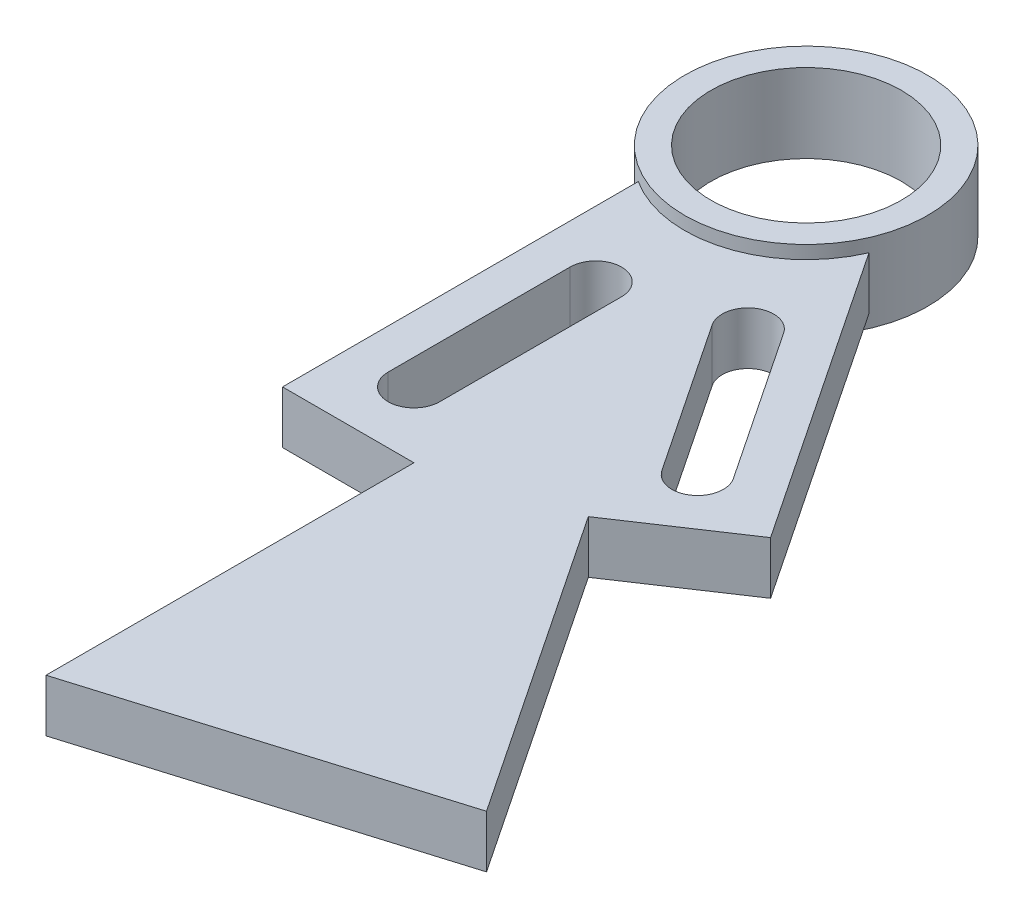
from build123d import *

# Parameters (mm, degrees)
SKETCH1_R             = 11.5062
BEARING_EXTRUDE_DEPTH = 4.7625
BOSS_EXTRUDE2_DEPTH   = 3.175


with BuildPart() as part:
    # Sketch1 → Bearing extrude (new, symmetric)
    with BuildSketch(Plane(origin=(0, 0, 0), x_dir=(1, 0, 0), z_dir=(0, 1, 0))):
        with BuildLine():
            ThreePointArc((14.6812, 0), (-7.035822924, 12.885450292), (-7.9375, -12.350454534))
            ThreePointArc((-7.9375, -12.350454534), (4.257656572, -14.050266686), (13.457937336, -5.866988674))
            ThreePointArc((13.457937336, -5.866988674), (14.372131071, -2.996578368), (14.6812, 0))
        make_face()
        Circle(SKETCH1_R, mode=Mode.SUBTRACT)
    extrude(amount=BEARING_EXTRUDE_DEPTH, both=True)

    # Sketch1<5> → Boss-Extrude2 (add, symmetric)
    with BuildSketch(Plane(origin=(0, 0, 0), x_dir=(1, 0, 0), z_dir=(0, 1, 0))):
        with BuildLine():
            Line((-7.9375, -12.350454534), (-7.9375, -55.3212))
            Line((-7.9375, -55.3212), (7.9375, -55.3212))
            Line((7.9375, -55.3212), (7.9375, -99.7712))
            Line((7.9375, -99.7712), (48.779482338, -87.394841716))
            Line((48.779482338, -87.394841716), (24.105806981, -50.421713036))
            Line((24.105806981, -50.421713036), (30.708151388, -46.015699579))
            Line((30.708151388, -46.015699579), (37.310495795, -41.609686123))
            Line((37.310495795, -41.609686123), (13.457937336, -5.866988674))
            ThreePointArc((13.457937336, -5.866988674), (4.257656572, -14.050266686), (-7.9375, -12.350454534))
        make_face()
        with BuildLine():
            ThreePointArc((3.1115, -47.3837), (0, -50.4952), (-3.1115, -47.3837))
            Line((-3.1115, -47.3837), (-3.1115, -25.4127))
            ThreePointArc((-3.1115, -25.4127), (0, -22.3012), (3.1115, -25.4127))
            Line((3.1115, -25.4127), (3.1115, -47.3837))
        make_face(mode=Mode.SUBTRACT)
        with BuildLine():
            ThreePointArc((28.890256939, -37.686197897), (29.353499053, -40.022147052), (28.029295206, -42.00147418))
            ThreePointArc((28.029295206, -42.00147418), (25.693346052, -42.464716295), (23.714018923, -41.140512447))
            Line((23.714018923, -41.140512447), (11.518173675, -22.865223129))
            ThreePointArc((11.518173675, -22.865223129), (12.379135408, -18.549946846), (16.69441169, -19.410908579))
            Line((16.69441169, -19.410908579), (28.890256939, -37.686197897))
        make_face(mode=Mode.SUBTRACT)
    extrude(amount=BOSS_EXTRUDE2_DEPTH, both=True)


solid = part.part
